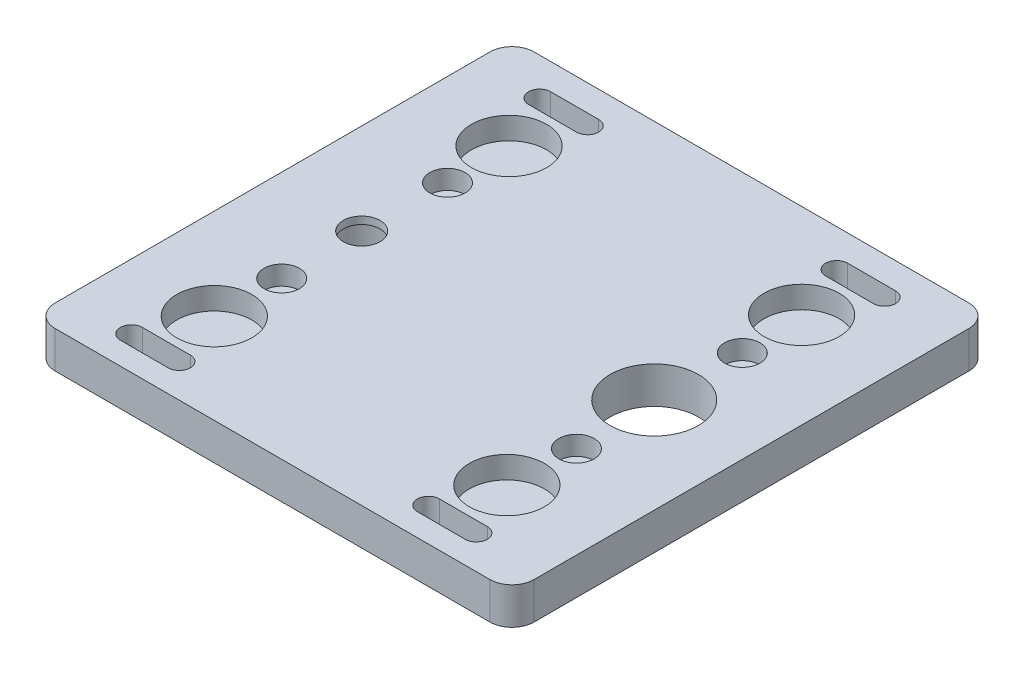
from build123d import *

# Parameters (mm, degrees)
CROQUIS1_W              = 65
CROQUIS1_H              = 65
CROQUIS1_R              = 5.1
CROQUIS1_R_2            = 6
CROQUIS1_R_3            = 4.6
SALIENTE_EXTRUIR1_DEPTH = 5
REDONDEO2_R             = 3
CROQUIS2_R              = 4.6
SALIENTE_EXTRUIR2_DEPTH = 1
CROQUIS3_R              = 2.5
CORTAR_EXTRUIR1_DEPTH   = 1
CROQUIS4_R              = 2.4
CORTAR_EXTRUIR2_DEPTH   = 10
CROQUIS5_R              = 2.4
CROQUIS5_R_2            = 1.25
SALIENTE_EXTRUIR3_DEPTH = 2.4
SALIENTE_EXTRUIR4_START = -2
CROQUIS6_R              = 5.1
SALIENTE_EXTRUIR4_DEPTH = 2


with BuildPart() as part:
    # Croquis1 → Saliente-Extruir1 (new body)
    with BuildSketch(Plane.XZ):
        with Locations((-15.241230111, -32.770729042)):
            Rectangle(CROQUIS1_W, CROQUIS1_H)
        with Locations((-35.389174066, -12.520729042)):
            Circle(CROQUIS1_R, mode=Mode.SUBTRACT)
        with Locations((4.310825934, -12.520729042)):
            Circle(CROQUIS1_R, mode=Mode.SUBTRACT)
        with Locations((-35.389174066, -52.520729042)):
            Circle(CROQUIS1_R, mode=Mode.SUBTRACT)
        with Locations((4.310825934, -52.520729042)):
            Circle(CROQUIS1_R, mode=Mode.SUBTRACT)
        with Locations((4.310825934, -32.520729042)):
            Circle(CROQUIS1_R_2, mode=Mode.SUBTRACT)
        with Locations((-35.389174066, -32.520729042)):
            Circle(CROQUIS1_R_3, mode=Mode.SUBTRACT)
        with BuildLine():
            Line((-32.439174066, -6.320729042), (-38.939173538, -6.320729042))
            ThreePointArc((-38.939173538, -6.320729042), (-40.439173538, -4.820729042), (-38.939173538, -3.320729042))
            Line((-38.939173538, -3.320729042), (-32.439174066, -3.320729042))
            ThreePointArc((-32.439174066, -3.320729042), (-30.939174066, -4.820729042), (-32.439174066, -6.320729042))
        make_face(mode=Mode.SUBTRACT)
        with BuildLine():
            Line((7.860825934, -6.320729042), (1.360825562, -6.320729042))
            ThreePointArc((1.360825562, -6.320729042), (-0.139174438, -4.820729042), (1.360825562, -3.320729042))
            Line((1.360825562, -3.320729042), (7.860825934, -3.320729042))
            ThreePointArc((7.860825934, -3.320729042), (9.360825934, -4.820729042), (7.860825934, -6.320729042))
        make_face(mode=Mode.SUBTRACT)
        with BuildLine():
            Line((-38.939173538, -58.720729042), (-32.439174066, -58.720729042))
            ThreePointArc((-32.439174066, -58.720729042), (-30.939174066, -60.220729042), (-32.439174066, -61.720729042))
            Line((-32.439174066, -61.720729042), (-38.939173538, -61.720729042))
            ThreePointArc((-38.939173538, -61.720729042), (-40.439173538, -60.220729042), (-38.939173538, -58.720729042))
        make_face(mode=Mode.SUBTRACT)
        with BuildLine():
            Line((7.860825934, -61.720729042), (1.360825562, -61.720729042))
            ThreePointArc((1.360825562, -61.720729042), (-0.139174438, -60.220729042), (1.360825562, -58.720729042))
            Line((1.360825562, -58.720729042), (7.860825934, -58.720729042))
            ThreePointArc((7.860825934, -58.720729042), (9.360825934, -60.220729042), (7.860825934, -61.720729042))
        make_face(mode=Mode.SUBTRACT)
    extrude(amount=SALIENTE_EXTRUIR1_DEPTH)

    # Redondeo2
    redondeo2_edges = [part.edges().sort_by_distance(p)[0] for p in [
        (-47.741230111, -2.5, -0.270729042),
        (17.258769889, -2.5, -0.270729042),
        (17.258769889, -2.5, -65.270729042),
        (-47.741230111, -2.5, -65.270729042),
    ]]
    fillet(redondeo2_edges, radius=REDONDEO2_R)

    # Croquis2 → Saliente-Extruir2 (add)
    with BuildSketch(Plane(origin=(0, 0, 0), x_dir=(1, 0, 0), z_dir=(0, 1, 0))):
        with Locations(Location((-35.389174066, 32.520729042, 0), (0, 0, 180))):
            Circle(CROQUIS2_R)
    extrude(amount=-SALIENTE_EXTRUIR2_DEPTH)

    # Croquis3 → Cortar-Extruir1 (cut)
    with BuildSketch(Plane.XZ.offset(1)):
        with Locations((-35.389174066, -32.520729042)):
            Circle(CROQUIS3_R)
    extrude(amount=-CORTAR_EXTRUIR1_DEPTH, mode=Mode.SUBTRACT)

    # Croquis4 → Cortar-Extruir2 (cut)
    with BuildSketch(Plane.XZ.offset(5)):
        with Locations((-35.241230111, -44.020729042)):
            Circle(CROQUIS4_R)
        with Locations((-35.241230111, -21.520729042)):
            Circle(CROQUIS4_R)
        with Locations((4.758769889, -21.520729042)):
            Circle(CROQUIS4_R)
        with Locations((4.758769889, -44.020729042)):
            Circle(CROQUIS4_R)
    extrude(amount=-CORTAR_EXTRUIR2_DEPTH, mode=Mode.SUBTRACT)

    # Croquis5 → Saliente-Extruir3 (add)
    # profile 1 of 4: a face of its own
    with BuildSketch(Plane.XZ.offset(5)):
        with Locations((-35.241230111, -44.020729042)):
            Circle(CROQUIS5_R)
        with Locations((-35.241230111, -44.020729042)):
            Circle(CROQUIS5_R_2, mode=Mode.SUBTRACT)
    # profile 2 of 4: a face of its own
    with BuildSketch(Plane.XZ.offset(5)):
        with Locations((-35.241230111, -21.520729042)):
            Circle(CROQUIS5_R)
        with Locations((-35.241230111, -21.520729042)):
            Circle(CROQUIS5_R_2, mode=Mode.SUBTRACT)
    # profile 3 of 4: a face of its own
    with BuildSketch(Plane.XZ.offset(5)):
        with Locations((4.758769889, -21.520729042)):
            Circle(CROQUIS5_R)
        with Locations((4.758769889, -21.520729042)):
            Circle(CROQUIS5_R_2, mode=Mode.SUBTRACT)
    # profile 4 of 4: a face of its own
    with BuildSketch(Plane.XZ.offset(5)):
        with Locations((4.758769889, -44.020729042)):
            Circle(CROQUIS5_R)
        with Locations((4.758769889, -44.020729042)):
            Circle(CROQUIS5_R_2, mode=Mode.SUBTRACT)
    extrude(amount=-SALIENTE_EXTRUIR3_DEPTH)

    # Croquis6 → Saliente-Extruir4 (add)
    with BuildSketch(Plane.XZ.offset(5).offset(SALIENTE_EXTRUIR4_START)):
        with Locations((-35.389174066, -52.520729042)):
            Circle(CROQUIS6_R)
        with Locations((4.310825934, -52.520729042)):
            Circle(CROQUIS6_R)
        with Locations((4.310825934, -12.520729042)):
            Circle(CROQUIS6_R)
        with Locations((-35.389174066, -12.520729042)):
            Circle(CROQUIS6_R)
    extrude(amount=SALIENTE_EXTRUIR4_DEPTH)


solid = part.part
